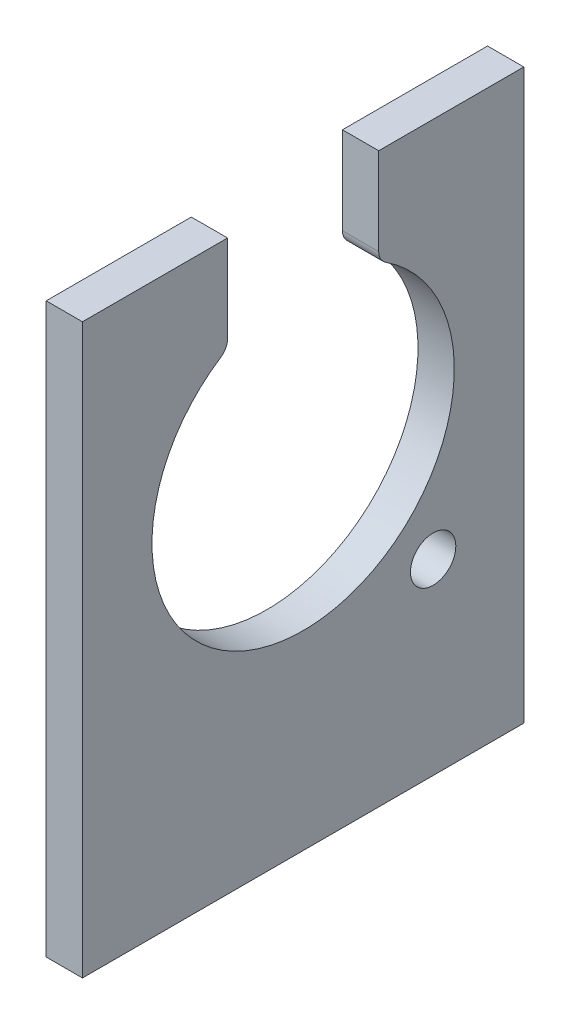
from build123d import *

# Parameters (mm, degrees)
BOSS_EXTRUDE1_DEPTH = 12
SKETCH2_R           = 7.5
CUT_EXTRUDE1_DEPTH  = 120.620232402


with BuildPart() as part:
    # Sketch1 → Boss-Extrude1 (new body)
    with BuildSketch(Plane(origin=(0, 0, 0), x_dir=(0, 0, -1), z_dir=(1, 0, 0))):
        with BuildLine():
            Line((73, 94), (25, 94))
            Line((25, 94), (25, 65.097722286))
            ThreePointArc((25, 65.097722286), (25.604754635, 62.714065813), (27.272727273, 60.90702026))
            ThreePointArc((27.272727273, 60.90702026), (0, -31), (-27.272727273, 60.90702026))
            ThreePointArc((-27.272727273, 60.90702026), (-25.604754635, 62.714065813), (-25, 65.097722286))
            Line((-25, 65.097722286), (-25, 94))
            Line((-25, 94), (-73, 94))
            Line((-73, 94), (-73, -94))
            Line((-73, -94), (73, -94))
            Line((73, -94), (73, 94))
        make_face()
    extrude(amount=BOSS_EXTRUDE1_DEPTH)

    # Sketch2 → Cut-Extrude1 (cut, through all)
    with BuildSketch(Plane(origin=(12, 0, 0), x_dir=(0, 0, -1), z_dir=(1, 0, 0))):
        with Locations((43, -32)):
            Circle(SKETCH2_R)
    extrude(amount=-CUT_EXTRUDE1_DEPTH, mode=Mode.SUBTRACT)


solid = part.part
